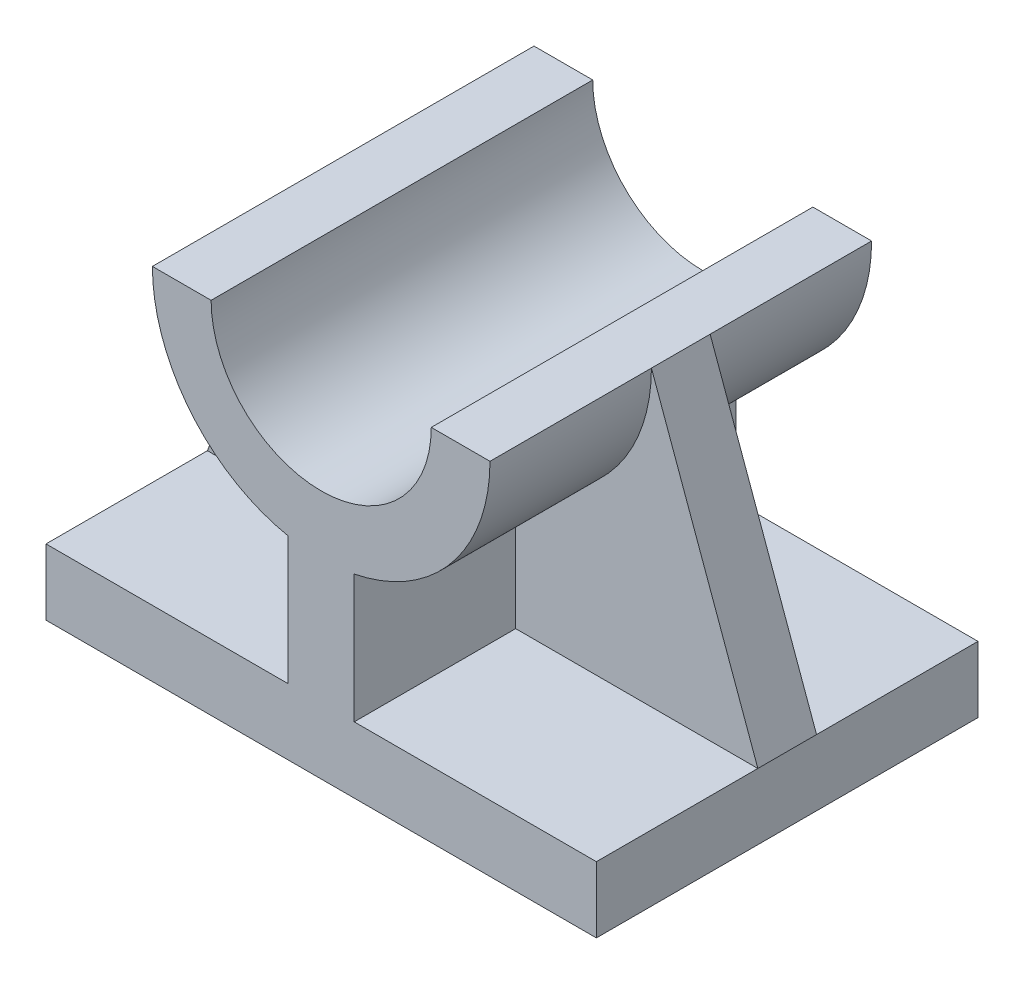
from build123d import *

# Parameters (mm, degrees)
BOSS_EXTRUDE2_DEPTH = 660.4
RIB1_REACH          = 1620.939
SKETCH2_WALL_W      = 4320.572024226
SKETCH2_WALL_H      = 203.2


with BuildPart() as part:
    # Sketch1 → Boss-Extrude2 (new, symmetric)
    with BuildSketch(Plane.XY):
        with BuildLine():
            Line((-584.2, 1130.3), (-381, 1130.3))
            ThreePointArc((-381, 1130.3), (0, 749.3), (381, 1130.3))
            Line((381, 1130.3), (584.2, 1130.3))
            ThreePointArc((584.2, 1130.3), (451.698848792, 759.816815496), (114.3, 557.390626713))
            Line((114.3, 557.390626713), (114.3, 114.3))
            Line((114.3, 114.3), (952.5, 114.3))
            Line((952.5, 114.3), (952.5, -114.3))
            Line((952.5, -114.3), (-952.5, -114.3))
            Line((-952.5, -114.3), (-952.5, 114.3))
            Line((-952.5, 114.3), (-114.3, 114.3))
            Line((-114.3, 114.3), (-114.3, 557.390626713))
            ThreePointArc((-114.3, 557.390626713), (-451.698848792, 759.816815496), (-584.2, 1130.3))
        make_face()
    extrude(amount=BOSS_EXTRUDE2_DEPTH, both=True)

    # Sketch2 wall → Rib1 (add, up to next)
    with BuildSketch(Plane(origin=(768.35, 622.3, 0), x_dir=(0.340799323621, -0.940136065162, 0), z_dir=(0.940136065162, 0.340799323621, 0)), mode=Mode.PRIVATE) as rib1_sk1:
        Rectangle(SKETCH2_WALL_W, SKETCH2_WALL_H)
    rib1_tool1 = extrude(rib1_sk1.sketch, amount=-RIB1_REACH, mode=Mode.PRIVATE) - part.part
    rib1 = rib1_tool1.solids().sort_by_distance((768.35, 622.3, 0))[0]
    add(rib1)

    # Mirror5: Rib1 across plane
    add(rib1.mirror(Plane(origin=(0, 0, 0), x_dir=(0, 0, 1), z_dir=(1, 0, 0))))


solid = part.part
